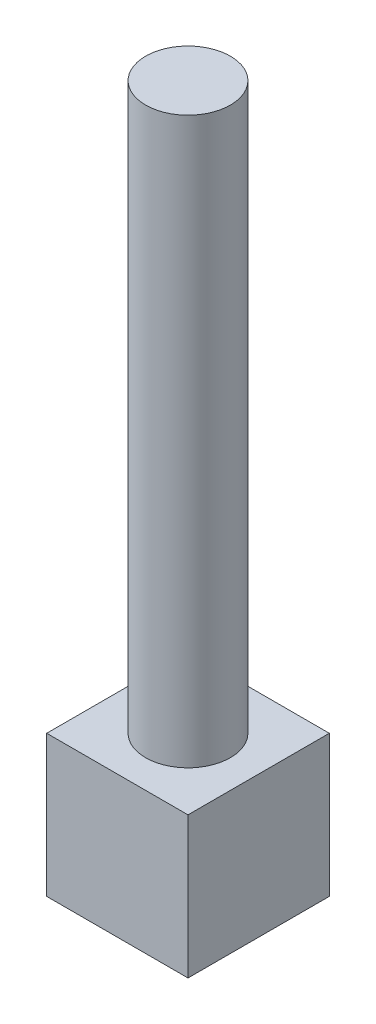
from build123d import *

# Parameters (mm, degrees)
SKETCH_2_W      = 10
SKETCH_2_H      = 10
EXTRUDE_2_DEPTH = 10
SKETCH_3_R      = 3
EXTRUDE_3_DEPTH = 40


with BuildPart() as part:
    # 草图2 → 凸台-拉伸2 (new body)
    with BuildSketch(Plane(origin=(0, 0, 0), x_dir=(1, 0, 0), z_dir=(0, 1, 0))):
        with Locations((-28.987967914, 3.735294118)):
            Rectangle(SKETCH_2_W, SKETCH_2_H)
    extrude(amount=EXTRUDE_2_DEPTH)

    # 草图3 → 凸台-拉伸3 (add)
    with BuildSketch(Plane(origin=(0, 10, 0), x_dir=(1, 0, 0), z_dir=(0, 1, 0))):
        with Locations(Location((-28.987967914, 3.735294118, 0), (0, 0, 270))):
            Circle(SKETCH_3_R)
    extrude(amount=EXTRUDE_3_DEPTH)


solid = part.part
